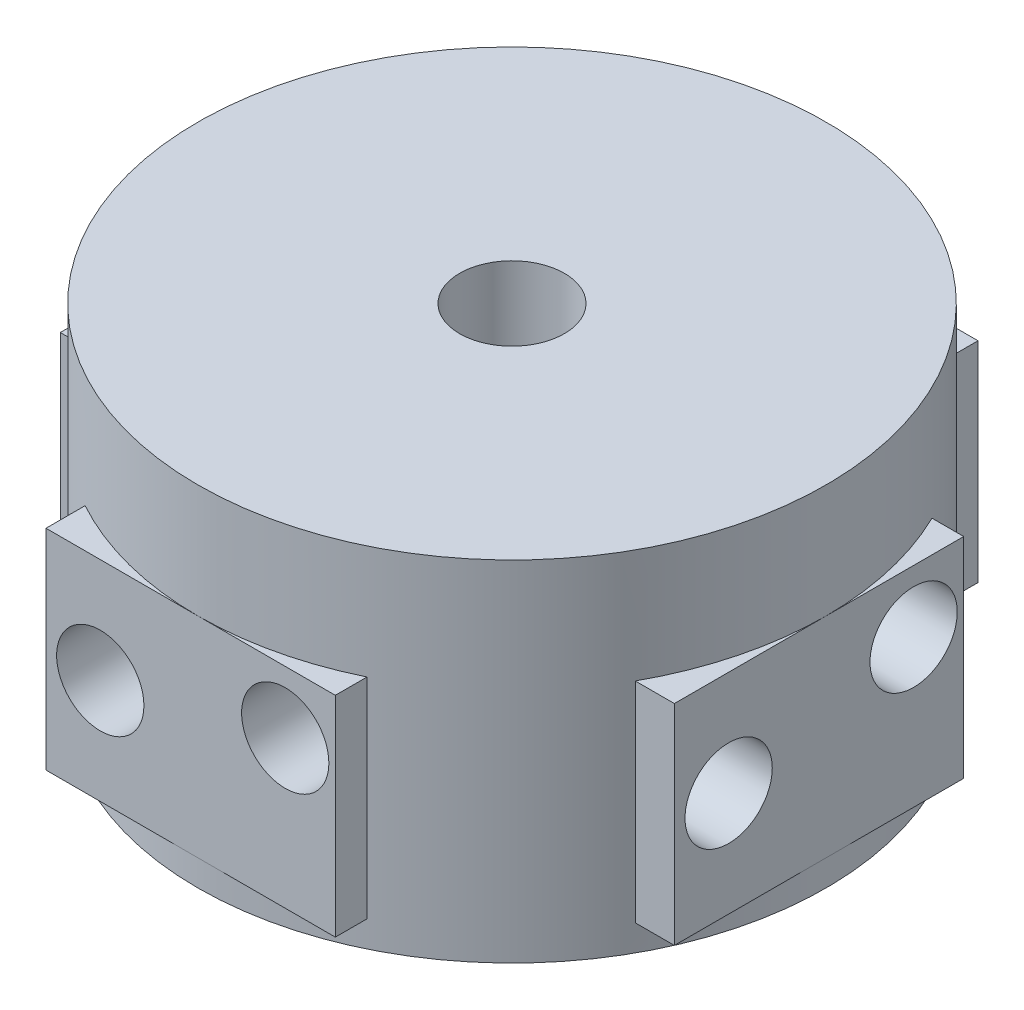
from build123d import *

# Parameters (mm, degrees)
ESQUISSE1_R                  = 18
ESQUISSE1_R_2                = 3
BOSS_EXTRU_1_DEPTH           = 20
BOSS_EXTRU_2_REACH           = 46.944
BOSS_EXTRU_2_END_RADIUS      = 18
ESQUISSE2_W                  = 16.575364331
ESQUISSE2_H                  = 12
ESQUISSE2_R                  = 2.5
ESQUISSE3_R                  = 2.5
ENL_V_MAT_EXTRU_1_DEPTH      = 8
R_P_TITION_CIRCULAIRE1_COUNT = 4


with BuildPart() as part:
    # Esquisse1 → Boss.-Extru.1 (new body)
    with BuildSketch(Plane(origin=(0, 0, 0), x_dir=(1, 0, 0), z_dir=(0, 1, 0))):
        with Locations(Location((0, 0, 0), (0, 0, 270))):
            Circle(ESQUISSE1_R)
        with Locations(Location((0, 0, 0), (0, 0, 270))):
            Circle(ESQUISSE1_R_2, mode=Mode.SUBTRACT)
    extrude(amount=BOSS_EXTRU_1_DEPTH)

    # Boss.-Extru.2: up to this cylinder (the profile starts outside it)
    boss_extru_2_end = Plane(origin=(0, 7.199085, 0), z_dir=(0, -1, 0)) * Cylinder(BOSS_EXTRU_2_END_RADIUS, 130.888, mode=Mode.PRIVATE)
    # Esquisse2 → Boss.-Extru.2 (add, up to the surface)
    with BuildSketch(Plane.ZY.offset(18), mode=Mode.PRIVATE) as boss_extru_2_sk1:
        with Locations((-0.409721573, 7.5)):
            Rectangle(ESQUISSE2_W, ESQUISSE2_H)
        with Locations((-5.58835764, 7.5)):
            Circle(ESQUISSE2_R, mode=Mode.SUBTRACT)
        with Locations((5.008479737, 9.946472677)):
            Circle(ESQUISSE2_R, mode=Mode.SUBTRACT)
    boss_extru_2_tool1 = extrude(boss_extru_2_sk1.sketch, amount=-BOSS_EXTRU_2_REACH, mode=Mode.PRIVATE) - boss_extru_2_end
    boss_extru_2 = boss_extru_2_tool1.solids().sort_by_distance((-18, 7.199085, -0.439188))[0] + boss_extru_2_tool1.solids().sort_by_distance((-18, 7.199085, -0.439188))[1]
    add(boss_extru_2)

    # Esquisse3 → Enlèv. mat.-Extru.1 (cut)
    with BuildSketch(Plane.ZY.offset(18)):
        with Locations((5.008479737, 9.946472677)):
            Circle(ESQUISSE3_R)
        with Locations((-5.58835764, 7.5)):
            Circle(ESQUISSE3_R)
    enl_v_mat_extru_1 = extrude(amount=-ENL_V_MAT_EXTRU_1_DEPTH, mode=Mode.SUBTRACT)

    # Répétition circulaire1: Boss.-Extru.2, Enlèv. mat.-Extru.1 ×4 about axis
    r_p_tition_circulaire1_axis = Axis((0, 0, 0), (0, 1, 0))
    add([boss_extru_2.rotate(r_p_tition_circulaire1_axis, i * 360 / R_P_TITION_CIRCULAIRE1_COUNT) for i in range(1, R_P_TITION_CIRCULAIRE1_COUNT)])
    add([enl_v_mat_extru_1.rotate(r_p_tition_circulaire1_axis, i * 360 / R_P_TITION_CIRCULAIRE1_COUNT) for i in range(1, R_P_TITION_CIRCULAIRE1_COUNT)], mode=Mode.SUBTRACT)


solid = part.part
